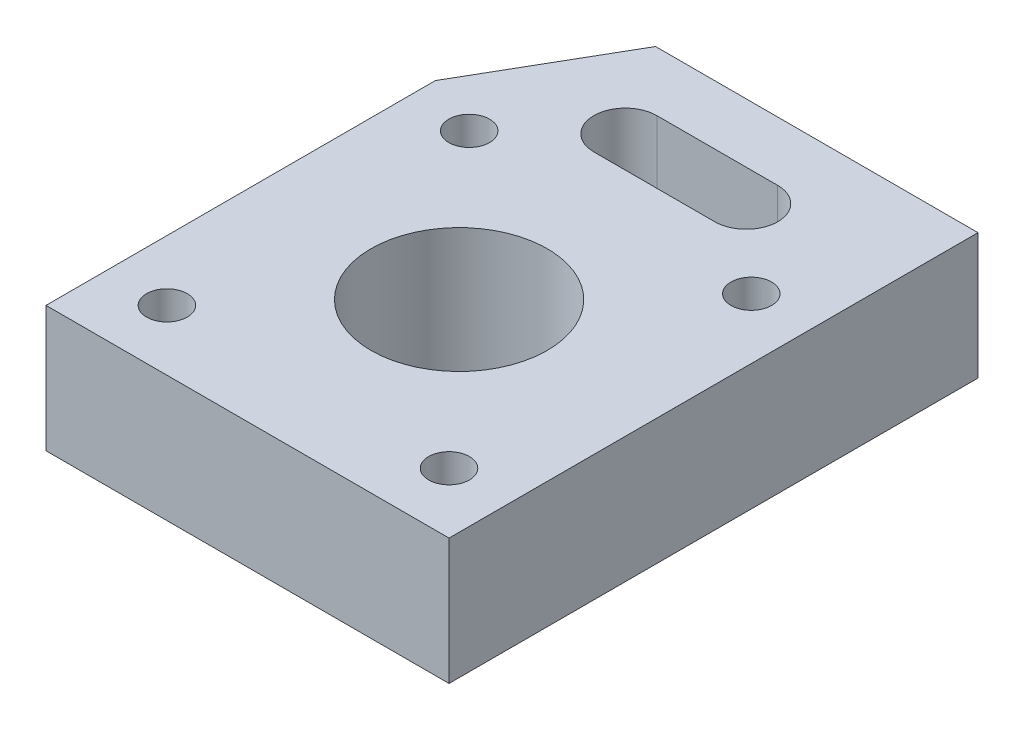
from build123d import *

# Parameters (mm, degrees)
SKETCH1_R           = 22.225
SKETCH1_R_2         = 5.1308
BOSS_EXTRUDE1_DEPTH = 31.75


with BuildPart() as part:
    # Sketch1 → Boss-Extrude1 (new body)
    with BuildSketch(Plane(origin=(0, 0, 0), x_dir=(1, 0, 0), z_dir=(0, 1, 0))):
        Polygon((-30.48, 80.01), (50.8, 80.01), (50.8, -53.34), (-50.8, -53.34), (-50.8, 44.81472759), align=None)
        with Locations(Location((0, 0, 0), (0, 0, 270))):
            Circle(SKETCH1_R, mode=Mode.SUBTRACT)
        with Locations(Location((35.56, 38.1, 0), (0, 0, 270))):
            Circle(SKETCH1_R_2, mode=Mode.SUBTRACT)
        with Locations(Location((-35.56, 38.1, 0), (0, 0, 270))):
            Circle(SKETCH1_R_2, mode=Mode.SUBTRACT)
        with Locations(Location((-35.56, -38.1, 0), (0, 0, 270))):
            Circle(SKETCH1_R_2, mode=Mode.SUBTRACT)
        with Locations(Location((35.56, -38.1, 0), (0, 0, 270))):
            Circle(SKETCH1_R_2, mode=Mode.SUBTRACT)
        with BuildLine():
            Line((-15.24, 65.0875), (15.24, 65.0875))
            ThreePointArc((15.24, 65.0875), (23.1775, 57.15), (15.24, 49.2125))
            Line((15.24, 49.2125), (-15.24, 49.2125))
            ThreePointArc((-15.24, 49.2125), (-23.1775, 57.15), (-15.24, 65.0875))
        make_face(mode=Mode.SUBTRACT)
    extrude(amount=BOSS_EXTRUDE1_DEPTH)


solid = part.part
